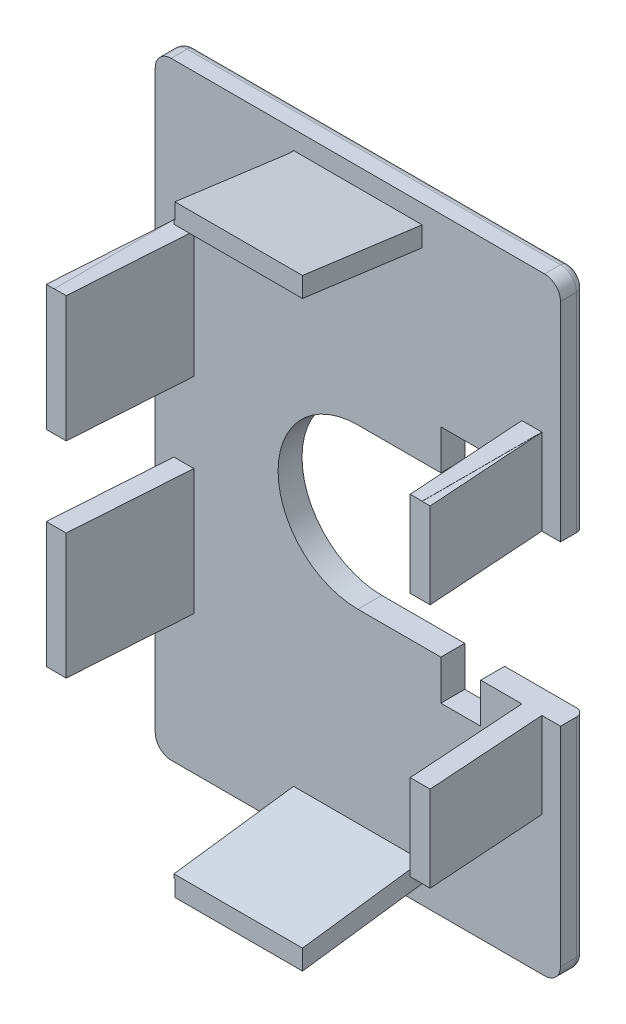
from build123d import *

# Parameters (mm, degrees)
CROQUIS1_W                  = 50.8
CROQUIS1_H                  = 76.2
SALIENTE_EXTRUIR1_DEPTH     = 18
CROQUIS2_W                  = 50.8
CROQUIS2_H                  = 76.2
CROQUIS2_W_2                = 46.12
CROQUIS2_H_2                = 71.52
CROQUIS2_W_3                = 38.8
CROQUIS2_H_3                = 64.2
CORTAR_EXTRUIR1_DEPTH       = 15
CORTAR_EXTRUIR8_DEPTH       = 15
SALIENTE_EXTRUIR3_DEPTH     = 41.5
CORTAR_EXTRUIR9_DEPTH       = 51.5
CORTAR_EXTRUIR10_DEPTH      = 51.5
SALIENTE_EXTRUIR4_DEPTH     = 16
CORTAR_EXTRUIR11_DEPTH      = 16.5
REDONDEO3_R                 = 2
REDONDEO4_R                 = 1
CROQUIS15_W                 = 48.12
CROQUIS15_H                 = 10
CORTAR_EXTRUIR12_DEPTH      = 15
CROQUIS16_W                 = 8
CROQUIS16_H                 = 1.5
CORTAR_EXTRUIR13_DEPTH      = 2
CORTAR_EXTRUIR16_DEPTH      = 49.184748624
CORTAR_EXTRUIR16_DEPTH_BACK = 49.184748624
CROQUIS18_R                 = 10
CROQUIS18_W                 = 2.5
CROQUIS18_H                 = 4.99
CROQUIS18_H_2               = 5.01
CROQUIS19_W                 = 5
CROQUIS19_H                 = 5
CORTAR_EXTRUIR17_DEPTH      = 49.184748624


with BuildPart() as part:
    # Croquis1 → Saliente-Extruir1 (new body)
    with BuildSketch(Plane.XY):
        Rectangle(CROQUIS1_W, CROQUIS1_H)
    extrude(amount=SALIENTE_EXTRUIR1_DEPTH)

    # Croquis2 → Cortar-Extruir1 (cut)
    # profile 1 of 2: a face of its own
    with BuildSketch(Plane.XY.offset(18)):
        Rectangle(CROQUIS2_W, CROQUIS2_H)
        Rectangle(CROQUIS2_W_2, CROQUIS2_H_2, mode=Mode.SUBTRACT)
    # profile 2 of 2: a face of its own
    with BuildSketch(Plane.XY.offset(18)):
        Rectangle(CROQUIS2_W_3, CROQUIS2_H_3)
    extrude(amount=-CORTAR_EXTRUIR1_DEPTH, mode=Mode.SUBTRACT)

    # Croquis6 → Cortar-Extruir8 (cut)
    with BuildSketch(Plane.XY.offset(18)):
        Polygon((-23.06, 35.76), (-8.06, 35.76), (-8.06, 32.1), (-19.4, 32.1), (-19.4, 20.76), (-23.06, 20.76), align=None)
        Polygon((23.06, 35.76), (8.06, 35.76), (8.06, 32.1), (19.4, 32.1), (19.4, 20.76), (23.06, 20.76), align=None)
        Polygon((-23.06, -35.76), (-23.06, -20.76), (-19.4, -20.76), (-19.4, -32.1), (-8.06, -32.1), (-8.06, -35.76), align=None)
        Polygon((23.06, -35.76), (8.06, -35.76), (8.06, -32.1), (19.4, -32.1), (19.4, -20.76), (23.06, -20.76), align=None)
    extrude(amount=-CORTAR_EXTRUIR8_DEPTH, mode=Mode.SUBTRACT)

    # Croquis10 → Saliente-Extruir3 (add)
    with BuildSketch(Plane(origin=(0, -20.76, 0), x_dir=(-1, 0, 0), z_dir=(0, -1, 0))):
        Polygon((23.06, -18), (24.06, -18), (23.06, -3), align=None)
        Polygon((-23.06, -18), (-24.06, -18), (-23.06, -3), align=None)
    extrude(amount=-SALIENTE_EXTRUIR3_DEPTH)

    # Croquis11 → Cortar-Extruir9 (cut)
    with BuildSketch(Plane.XZ.offset(20.76)):
        Polygon((-19.4, 18), (-21.56, 18), (-20.56, 3), (-19.4, 3), align=None)
    extrude(amount=-CORTAR_EXTRUIR9_DEPTH, mode=Mode.SUBTRACT)

    # Croquis12 → Cortar-Extruir10 (cut)
    with BuildSketch(Plane.XZ.offset(20.76)):
        Polygon((19.4, 18), (19.4, 3), (20.56, 3), (21.56, 18), align=None)
    extrude(amount=-CORTAR_EXTRUIR10_DEPTH, mode=Mode.SUBTRACT)

    # Croquis13 → Saliente-Extruir4 (add)
    with BuildSketch(Plane(origin=(8.06, 0, 0), x_dir=(0, 0, -1), z_dir=(1, 0, 0))):
        Polygon((-18, -35.76), (-18, -37.76), (-3, -35.76), align=None)
        Polygon((-18, 35.76), (-18, 37.76), (-3, 35.76), align=None)
    extrude(amount=-SALIENTE_EXTRUIR4_DEPTH)

    # Croquis14 → Cortar-Extruir11 (cut)
    with BuildSketch(Plane(origin=(8.06, 0, 0), x_dir=(0, 0, -1), z_dir=(1, 0, 0))):
        Polygon((-3, -32.1), (-18, -32.1), (-18, -35.26), (-3, -33.26), align=None)
        Polygon((-18, 32.1), (-18, 35.26), (-3, 33.26), (-3, 32.1), align=None)
    extrude(amount=-CORTAR_EXTRUIR11_DEPTH, mode=Mode.SUBTRACT)

    # Redondeo3
    redondeo3_edges = [part.edges().sort_by_distance(p)[0] for p in [
        (-25.4, 38.1, 1.5),
        (25.4, 38.1, 1.5),
        (25.4, -38.1, 1.5),
        (-25.4, -38.1, 1.5),
    ]]
    fillet(redondeo3_edges, radius=REDONDEO3_R)

    # Redondeo4
    redondeo4_edges = [part.edges().sort_by_distance(p)[0] for p in [
        (0, 38.1, 0),
        (-25.4, 0, 0),
        (25.4, 0, 0),
        (0, -38.1, 0),
        (24.814213562, -37.514213562, 0),
        (-24.814213562, -37.514213562, 0),
        (-24.814213562, 37.514213562, 0),
        (24.814213562, 37.514213562, 0),
    ]]
    fillet(redondeo4_edges, radius=REDONDEO4_R)

    # Croquis15 → Cortar-Extruir12 (cut)
    with BuildSketch(Plane.XY.offset(18)):
        with Locations((0, -0.01)):
            Rectangle(CROQUIS15_W, CROQUIS15_H)
    extrude(amount=-CORTAR_EXTRUIR12_DEPTH, mode=Mode.SUBTRACT)

    # Croquis16 → Cortar-Extruir13 (cut)
    with BuildSketch(Plane.XZ.offset(38.1)):
        with Locations((0, 2.25)):
            Rectangle(CROQUIS16_W, CROQUIS16_H)
    extrude(amount=-CORTAR_EXTRUIR13_DEPTH, mode=Mode.SUBTRACT)

    # Croquis18 → Cortar-Extruir16 (cut, two sides: drawn at the far end of the back side and taken through both)
    with BuildSketch(Plane.XY.offset(3).offset(-CORTAR_EXTRUIR16_DEPTH_BACK)):
        Circle(CROQUIS18_R)
        with Locations((21.81, -7.505)):
            Rectangle(CROQUIS18_W, CROQUIS18_H)
        with Locations((21.81, 7.495)):
            Rectangle(CROQUIS18_W, CROQUIS18_H_2)
        with BuildLine():
            Line((20.56, 10), (0, 10))
            ThreePointArc((0, 10), (7.071067812, 7.071067812), (10, 0))
            ThreePointArc((10, 0), (7.071067812, -7.071067812), (0, -10))
            Line((0, -10), (20.56, -10))
            Line((20.56, -10), (20.56, -5.01))
            Line((20.56, -5.01), (23.06, -5.01))
            Line((23.06, -5.01), (23.06, -10))
            Line((23.06, -10), (25.4, -10))
            Line((25.4, -10), (25.4, 10))
            Line((25.4, 10), (23.06, 10))
            Line((23.06, 10), (23.06, 4.99))
            Line((23.06, 4.99), (20.56, 4.99))
            Line((20.56, 4.99), (20.56, 10))
        make_face()
    extrude(amount=CORTAR_EXTRUIR16_DEPTH + CORTAR_EXTRUIR16_DEPTH_BACK, mode=Mode.SUBTRACT)

    # Croquis19 → Cortar-Extruir17 (cut, through all)
    with BuildSketch(Plane.XY.offset(3)):
        with Locations((12.9, 12.5)):
            Rectangle(CROQUIS19_W, CROQUIS19_H)
        with Locations((12.9, -12.5)):
            Rectangle(CROQUIS19_W, CROQUIS19_H)
    extrude(amount=-CORTAR_EXTRUIR17_DEPTH, mode=Mode.SUBTRACT)


solid = part.part
